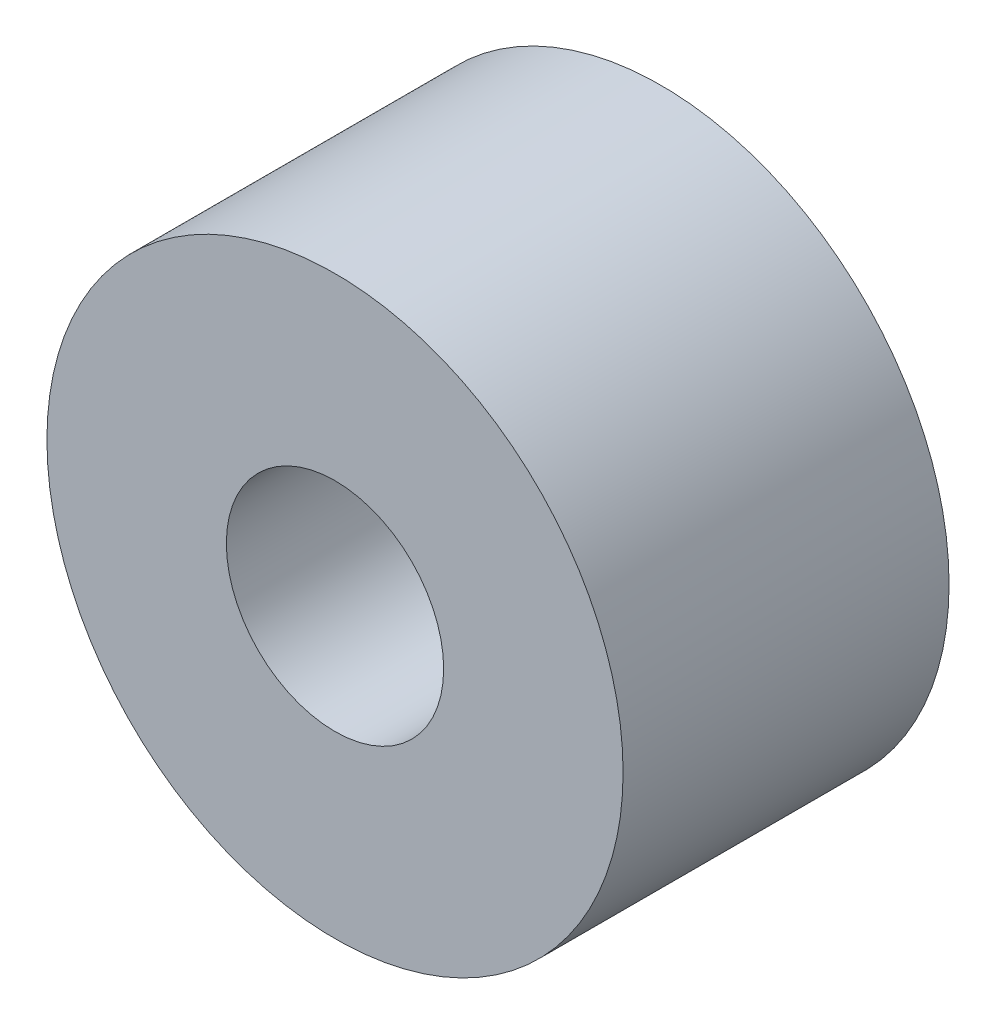
from build123d import *

# Parameters (mm, degrees)
SKETCH1_R      = 4.20878
SKETCH1_R_2    = 1.5875
EXTRUDE1_DEPTH = 2.38125


with BuildPart() as part:
    # Sketch1 → Extrude1 (new, symmetric)
    with BuildSketch(Plane.XY):
        with Locations(Location((0, 0, 0), (0, 0, 180))):
            Circle(SKETCH1_R)
        with Locations(Location((0, 0, 0), (0, 0, 180))):
            Circle(SKETCH1_R_2, mode=Mode.SUBTRACT)
    extrude(amount=EXTRUDE1_DEPTH, both=True)


solid = part.part
